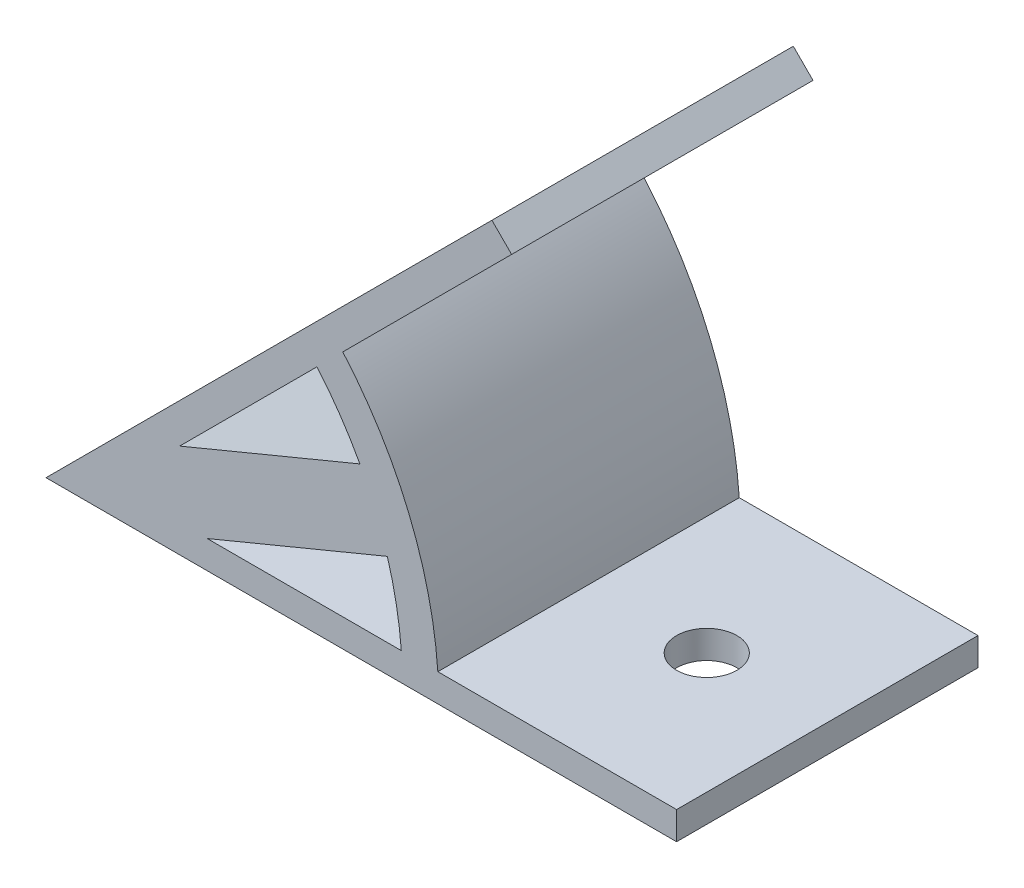
from build123d import *

# Parameters (mm, degrees)
EXTRUDE_1_DEPTH     = 25
SKETCH_4_R          = 2.5
CUT_EXTRUDE_1_DEPTH = 69.766316506
SKETCH_5_R          = 2.5
CUT_EXTRUDE_2_DEPTH = 69.766316506


with BuildPart() as part:
    # 草圖1 → 填料-伸長1 (new body)
    with BuildSketch(Plane.XY):
        with BuildLine():
            Line((0, 0), (52.305552833, 0))
            Line((52.305552833, 0), (52.305552833, 2.314523209))
            Line((52.305552833, 2.314523209), (32.501449094, 2.314523209))
            ThreePointArc((32.501449094, 2.314523209), (30.103466052, 12.469263913), (24.618610108, 21.345379996))
            Line((24.618610108, 21.345379996), (38.622226158, 35.348996046))
            Line((38.622226158, 35.348996046), (36.985611102, 36.985611102))
            Line((36.985611102, 36.985611102), (0, 0))
        make_face()
        with BuildLine():
            Line((29.470981811, 2.314523209), (13.368711302, 2.314523209))
            Line((13.368711302, 2.314523209), (28.312069292, 8.504264755))
            ThreePointArc((28.312069292, 8.504264755), (29.056814584, 5.44034124), (29.470981811, 2.314523209))
        make_face(mode=Mode.SUBTRACT)
        with BuildLine():
            Line((11.089721473, 7.816491361), (26.033079463, 14.006232908))
            ThreePointArc((26.033079463, 14.006232908), (24.393172815, 16.69936845), (22.475746143, 19.202516031))
            Line((22.475746143, 19.202516031), (11.089721473, 7.816491361))
        make_face(mode=Mode.SUBTRACT)
    extrude(amount=EXTRUDE_1_DEPTH)

    # 草圖4 → 除料-伸長1 (cut, through all)
    with BuildSketch(Plane.XZ):
        with Locations((42.305552833, 12.5)):
            Circle(SKETCH_4_R)
    extrude(amount=-CUT_EXTRUDE_1_DEPTH, mode=Mode.SUBTRACT)

    # 草圖5 → 除料-伸長2 (cut, through all)
    with BuildSketch(Plane(origin=(0, 0, 0), x_dir=(0, 0, 1), z_dir=(-0.7071067811865479, 0.7071067811865472, 0))):
        with Locations(Location((12.5, 42.305552833, 0), (0, 0, 270))):
            Circle(SKETCH_5_R)
    extrude(amount=-CUT_EXTRUDE_2_DEPTH, mode=Mode.SUBTRACT)


solid = part.part
